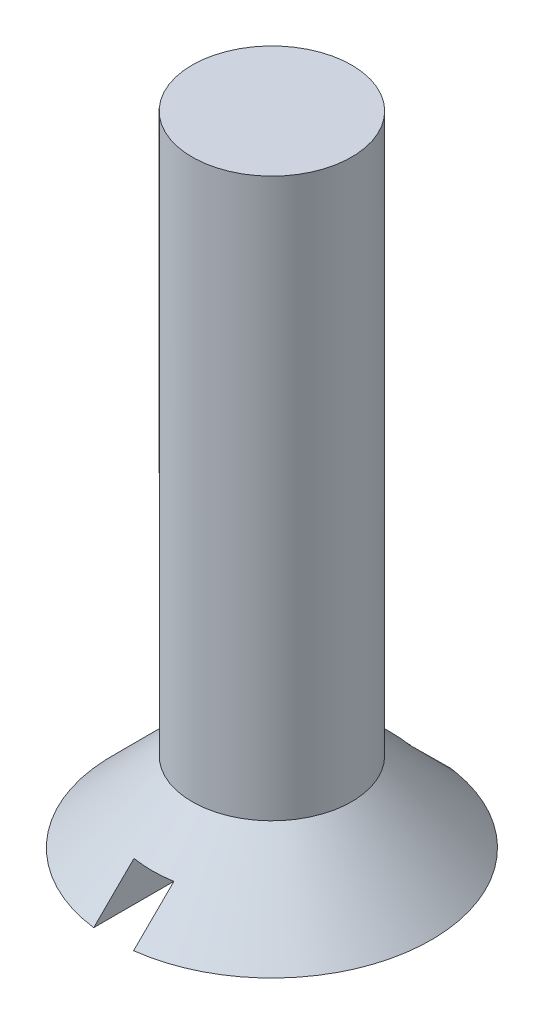
from build123d import *

# Parameters (mm, degrees)
SKETCH2_W          = 0.5
SKETCH2_H          = 4
CUT_EXTRUDE1_DEPTH = 0.5


with BuildPart() as part:
    # Sketch1 → Revolve1 (revolve)
    with BuildSketch(Plane.XY):
        Polygon((0, 8), (0, 0), (-2, 0), (-1, 1), (-1, 8), align=None)
    revolve(axis=Axis((0, 8, 0), (0, -1, 0)))

    # Sketch2 → Cut-Extrude1 (cut)
    with BuildSketch(Plane.XZ):
        Rectangle(SKETCH2_W, SKETCH2_H)
    extrude(amount=-CUT_EXTRUDE1_DEPTH, mode=Mode.SUBTRACT)


solid = part.part
